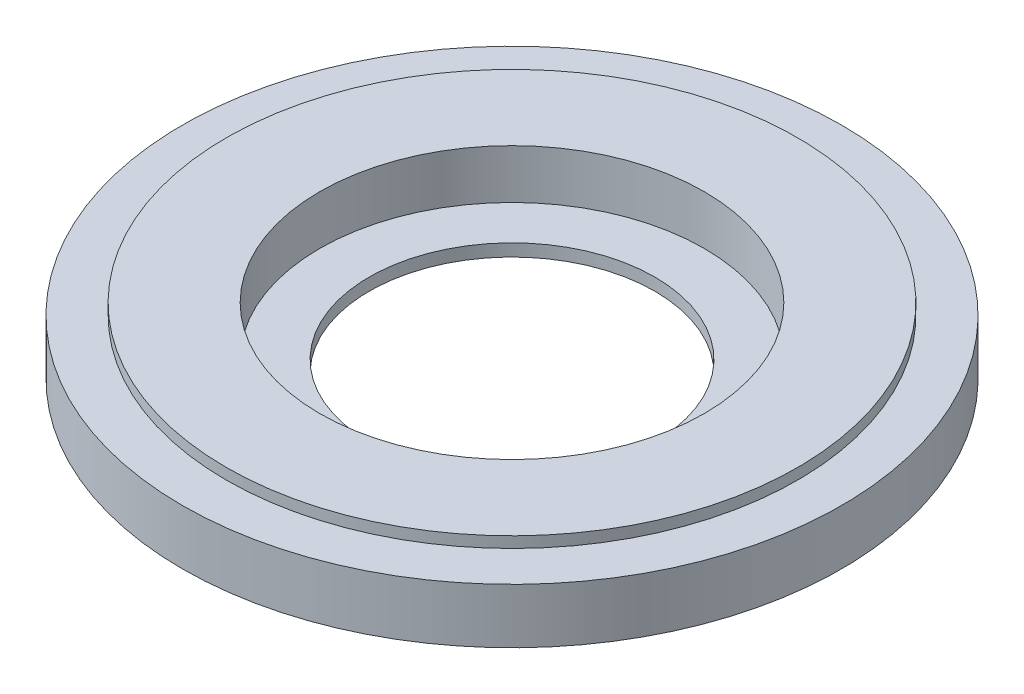
from build123d import *

# Parameters (mm, degrees)
SKETCH_1_R          = 30
EXTRUDE_1_DEPTH     = 5
SKETCH_2_R          = 26
EXTRUDE_2_DEPTH     = 1
SKETCH_3_R          = 18
CUT_EXTRUDE_1_DEPTH = 0.4
SKETCH_4_R          = 17.5
CUT_EXTRUDE_2_DEPTH = 4.48
SKETCH_5_R          = 13
CUT_EXTRUDE_3_DEPTH = 43.662283108


with BuildPart() as part:
    # 草图1 → 凸台-拉伸1 (new body)
    with BuildSketch(Plane(origin=(0, 0, 0), x_dir=(1, 0, 0), z_dir=(0, 1, 0))):
        with Locations(Location((0, 0, 0), (0, 0, 270))):
            Circle(SKETCH_1_R)
    extrude(amount=EXTRUDE_1_DEPTH)

    # 草图2 → 凸台-拉伸2 (add)
    with BuildSketch(Plane(origin=(0, 5, 0), x_dir=(1, 0, 0), z_dir=(0, 1, 0))):
        with Locations(Location((0, 0, 0), (0, 0, 270))):
            Circle(SKETCH_2_R)
    extrude(amount=EXTRUDE_2_DEPTH)

    # 草图3 → 切除-拉伸1 (cut)
    with BuildSketch(Plane.XZ):
        with Locations(Location((0, 0, 0), (0, 0, 270))):
            Circle(SKETCH_3_R)
    extrude(amount=-CUT_EXTRUDE_1_DEPTH, mode=Mode.SUBTRACT)

    # 草图4 → 切除-拉伸2 (cut)
    with BuildSketch(Plane(origin=(0, 6, 0), x_dir=(1, 0, 0), z_dir=(0, 1, 0))):
        with Locations(Location((0, 0, 0), (0, 0, 270))):
            Circle(SKETCH_4_R)
    extrude(amount=-CUT_EXTRUDE_2_DEPTH, mode=Mode.SUBTRACT)

    # 草图5 → 切除-拉伸3 (cut, through all)
    with BuildSketch(Plane(origin=(0, 1.52, 0), x_dir=(1, 0, 0), z_dir=(0, 1, 0))):
        with Locations(Location((0, 0, 0), (0, 0, 270))):
            Circle(SKETCH_5_R)
    extrude(amount=-CUT_EXTRUDE_3_DEPTH, mode=Mode.SUBTRACT)


solid = part.part
